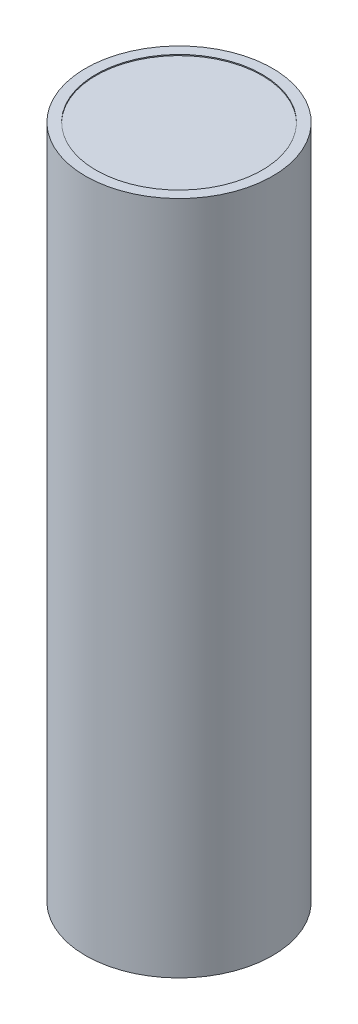
from build123d import *

# Parameters (mm, degrees)
SKETCH1_R           = 9
BOSS_EXTRUDE1_DEPTH = 65
SKETCH2_R           = 8
CUT_EXTRUDE1_DEPTH  = 0.1


with BuildPart() as part:
    # Sketch1 → Boss-Extrude1 (new body)
    with BuildSketch(Plane(origin=(0, 0, 0), x_dir=(1, 0, 0), z_dir=(0, 1, 0))):
        with Locations(Location((0, 0, 0), (0, 0, 270))):
            Circle(SKETCH1_R)
    extrude(amount=BOSS_EXTRUDE1_DEPTH)

    # Sketch2 → Cut-Extrude1 (cut)
    with BuildSketch(Plane(origin=(0, 65, 0), x_dir=(1, 0, 0), z_dir=(0, 1, 0))):
        with Locations(Location((0, 0, 0), (0, 0, 270))):
            Circle(SKETCH2_R)
    cut_extrude1 = extrude(amount=-CUT_EXTRUDE1_DEPTH, mode=Mode.SUBTRACT)

    # Mirror1: Cut-Extrude1 across plane
    add(cut_extrude1.mirror(Plane.ZX.offset(32.5)), mode=Mode.SUBTRACT)


solid = part.part
